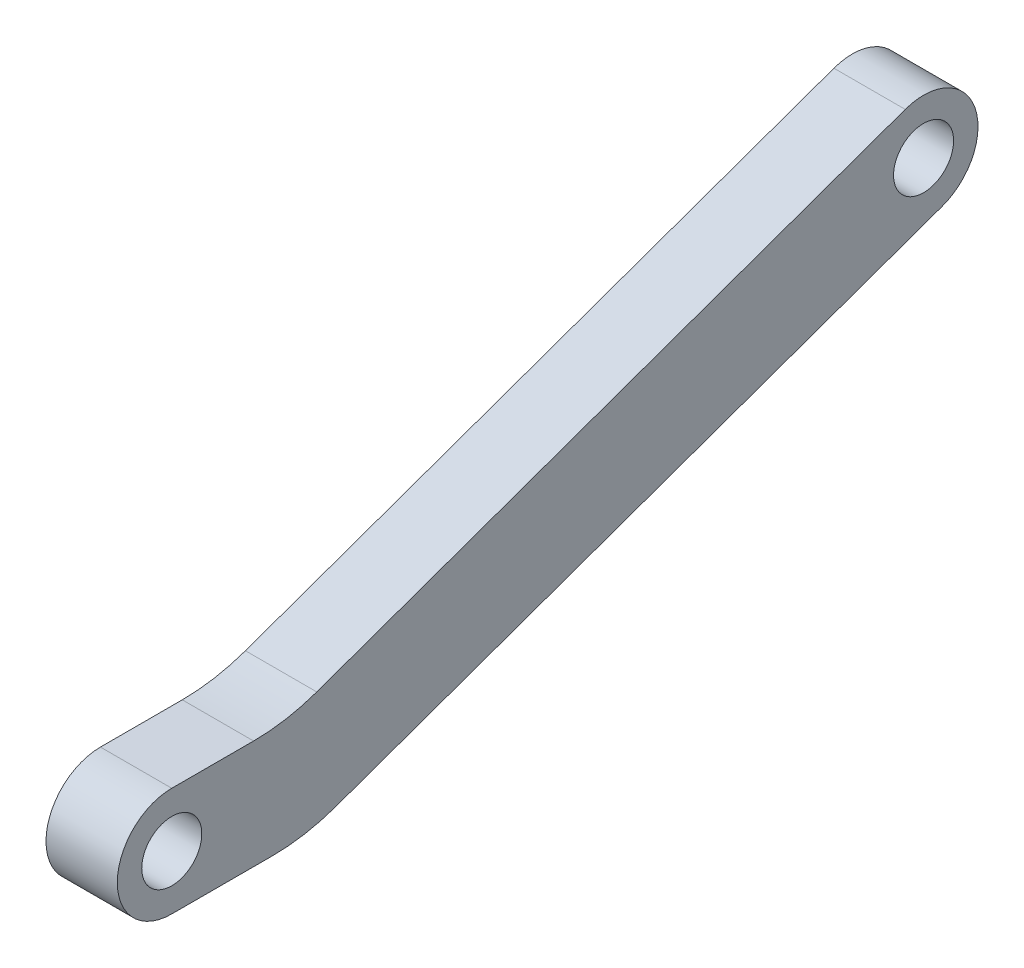
from build123d import *

# Parameters (mm, degrees)
SKETCH1_R           = 1.6
BOSS_EXTRUDE1_DEPTH = 1.9


with BuildPart() as part:
    # Sketch1 → Boss-Extrude1 (new, symmetric)
    with BuildSketch(Plane(origin=(0, 0, 0), x_dir=(0, 0, -1), z_dir=(1, 0, 0))):
        with BuildLine():
            Line((0, 2.9), (4.359548809, 2.9))
            ThreePointArc((4.359548809, 2.9), (6.066471506, 3.046756123), (7.723293933, 3.482717019))
            Line((7.723293933, 3.482717019), (39.074513914, 14.681012064))
            ThreePointArc((39.074513914, 14.681012064), (42.781012064, 12.925486086), (41.025486086, 9.218987936))
            Line((41.025486086, 9.218987936), (8.728054575, -2.317282981))
            ThreePointArc((8.728054575, -2.317282981), (7.071232149, -2.753243877), (5.364309451, -2.9))
            Line((5.364309451, -2.9), (0, -2.9))
            ThreePointArc((0, -2.9), (-2.9, 0), (0, 2.9))
        make_face()
        with Locations(Location((0, 0, 0), (0, 0, 180))):
            Circle(SKETCH1_R, mode=Mode.SUBTRACT)
        with Locations(Location((40.05, 11.95, 0), (0, 0, 180))):
            Circle(SKETCH1_R, mode=Mode.SUBTRACT)
    extrude(amount=BOSS_EXTRUDE1_DEPTH, both=True)


solid = part.part
